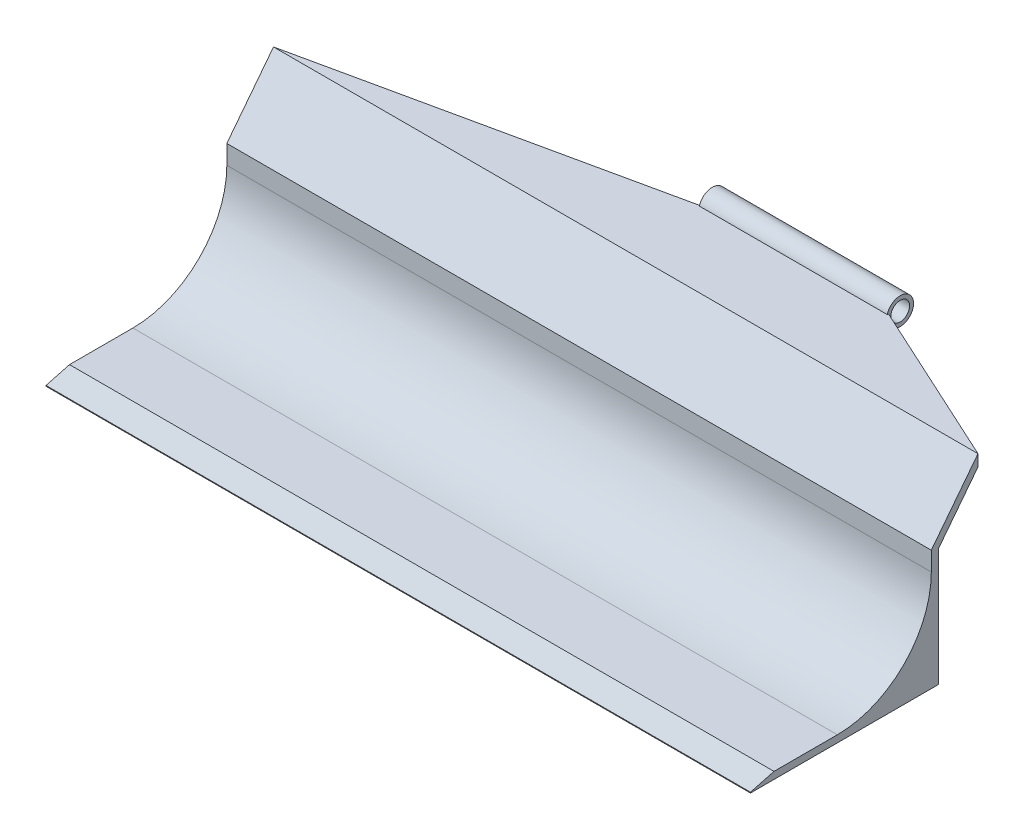
from build123d import *

# Parameters (mm, degrees)
BOSS_EXTRUDE1_DEPTH     = 300
FILLET1_R               = 40
CHAMFER1_SIZE           = 10
CHAMFER1_SIZE2          = 2.679491924
CUT_EXTRUDE1_DEPTH      = 336.036145422
CUT_EXTRUDE1_DEPTH_BACK = 336.036145422
SKETCH4_W               = 79.364416539
SKETCH4_H               = 3
BOSS_EXTRUDE2_DEPTH     = 10
SKETCH5_R               = 5.704192845
SKETCH5_R_2             = 4
BOSS_EXTRUDE3_DEPTH     = 80
SKETCH7_R               = 4
CUT_EXTRUDE2_DEPTH      = 80


with BuildPart() as part:
    # Sketch1 → Boss-Extrude1 (new body)
    with BuildSketch(Plane(origin=(0, 0, 0), x_dir=(0, 0, -1), z_dir=(1, 0, 0))):
        Polygon((84.922374429, -7.245973585), (84.922374429, -55.316210046), (7.922374429, -55.316210046), (7.922374429, -58.316210046), (87.922374429, -58.316210046), (87.922374429, -8.272692249), (106.273520759, 15.397445577), (137.289614993, 15.397445577), (137.289614993, 18.397445577), (104.803379808, 18.397445577), align=None)
    extrude(amount=BOSS_EXTRUDE1_DEPTH)

    # Fillet1
    fillet1_edges = [part.edges().sort_by_distance(p)[0] for p in [
        (150, -55.316210046, -84.922374429),
    ]]
    fillet(fillet1_edges, radius=FILLET1_R)

    # Chamfer1
    chamfer1_edges = [part.edges().sort_by_distance(p)[0] for p in [
        (150, -55.316210046, -7.922374429),
    ]]
    chamfer1_side = [part.faces().sort_by_distance(p)[0] for p in [
        (150, -55.316210046, -26.422374429),
    ]]
    chamfer(chamfer1_edges, length=CHAMFER1_SIZE, length2=CHAMFER1_SIZE2, reference=chamfer1_side[0])

    # Sketch2 → Cut-Extrude1 (cut, two sides: drawn at the far end of the back side and taken through both)
    with BuildSketch(Plane(origin=(0, 0, 0), x_dir=(1, 0, 0), z_dir=(0, 1, 0)).offset(-CUT_EXTRUDE1_DEPTH_BACK)):
        Polygon((229.364416539, 137.289614993), (300, 104.803379808), (319.87920565, 121.046497401), (319.87920565, 155.206469458), (246.417927531, 173.123323923), align=None)
        Polygon((150, 137.289614993), (0, 104.803379808), (-27.422104743, 146.559201032), (121.140212168, 173.123323923), align=None)
    extrude(amount=CUT_EXTRUDE1_DEPTH + CUT_EXTRUDE1_DEPTH_BACK, mode=Mode.SUBTRACT)

    # Sketch4 → Boss-Extrude2 (add)
    with BuildSketch(Plane(origin=(0, 0, -137.289614993), x_dir=(-1, 0, 0), z_dir=(0, 0, -1))):
        with Locations((-189.682208269, 16.897445577)):
            Rectangle(SKETCH4_W, SKETCH4_H)
    extrude(amount=BOSS_EXTRUDE2_DEPTH)

    # Sketch5 → Boss-Extrude3 (add)
    with BuildSketch(Plane(origin=(229.364416539, 0, 0), x_dir=(0, 0, -1), z_dir=(1, 0, 0))):
        with Locations((142.289614993, 16.897445577)):
            Circle(SKETCH5_R)
        with Locations((142.289614993, 16.897445577)):
            Circle(SKETCH5_R_2, mode=Mode.SUBTRACT)
    extrude(amount=-BOSS_EXTRUDE3_DEPTH)

    # Sketch7 → Cut-Extrude2 (cut)
    with BuildSketch(Plane(origin=(229.364416539, 0, 0), x_dir=(0, 0, -1), z_dir=(1, 0, 0))):
        with Locations((142.289614993, 16.897445577)):
            Circle(SKETCH7_R)
    extrude(amount=-CUT_EXTRUDE2_DEPTH, mode=Mode.SUBTRACT)


solid = part.part
